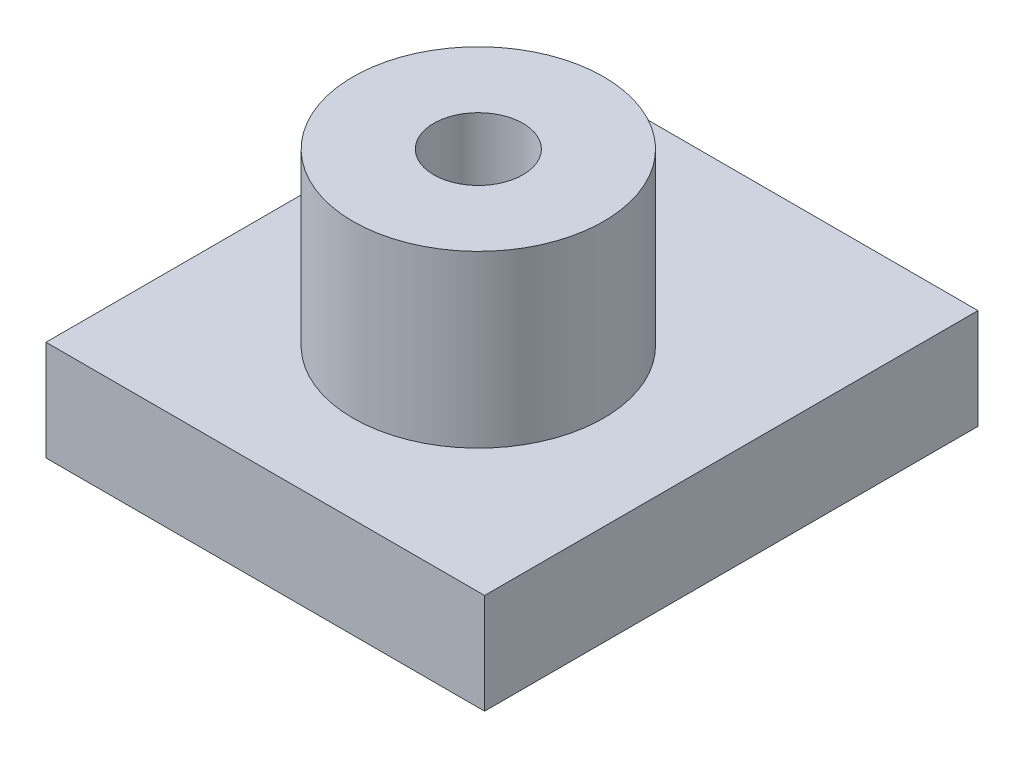
from build123d import *

# Parameters (mm, degrees)
SKETCH1_W             = 11.1125
SKETCH1_H             = 12.50125
BOSS_EXTRUDE1_DEPTH   = 2.54
SKETCH2_R             = 3.175
BOSS_EXTRUDE2_DEPTH   = 4.318
F_4_40_TAPPED_HOLE1_D = 2.2606


with BuildPart() as part:
    # Sketch1 → Boss-Extrude1 (new body)
    with BuildSketch(Plane(origin=(0, 0, 0), x_dir=(1, 0, 0), z_dir=(0, 1, 0))):
        with Locations((0, 16.881673618)):
            Rectangle(SKETCH1_W, SKETCH1_H)
    extrude(amount=BOSS_EXTRUDE1_DEPTH)

    # Sketch2 → Boss-Extrude2 (add)
    with BuildSketch(Plane(origin=(0, 2.54, 0), x_dir=(1, 0, 0), z_dir=(0, 1, 0))):
        with Locations(Location((0, 16.028548618, 0), (0, 0, 90))):
            Circle(SKETCH2_R)
    extrude(amount=BOSS_EXTRUDE2_DEPTH)

    # #4-40 Tapped Hole1 (through all)
    with Locations(Plane(origin=(0, 6.858, 0), x_dir=(-1, 0, 0), z_dir=(0, 1, 0))):
        with Locations((0, -16.028548618)):
            Hole(F_4_40_TAPPED_HOLE1_D / 2)


solid = part.part
